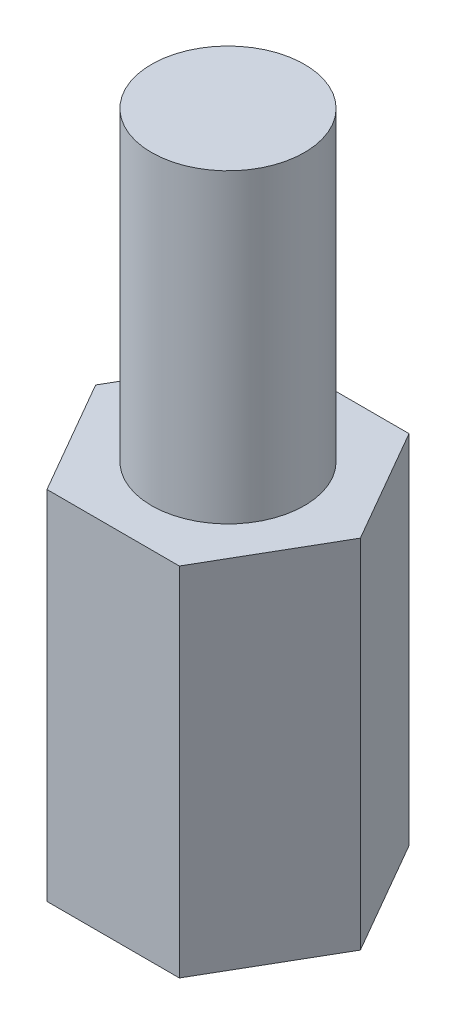
from build123d import *

# Parameters (mm, degrees)
EXTRUDE_1_DEPTH     = 7
SKETCH_2_R          = 1.25
CUT_EXTRUDE_1_DEPTH = 6.5
SKETCH_3_R          = 1.5
EXTRUDE_2_DEPTH     = 6


with BuildPart() as part:
    # Эскиз1 → Бобышка-Вытянуть1 (new body)
    with BuildSketch(Plane(origin=(0, 0, 0), x_dir=(1, 0, 0), z_dir=(0, 1, 0))):
        Polygon((-1.301734413, -2.25), (1.297689952, -2.252335071), (2.599424365, -0.002335071), (1.301734413, 2.25), (-1.297689952, 2.252335071), (-2.599424365, 0.002335071), align=None)
    extrude(amount=EXTRUDE_1_DEPTH)

    # Эскиз2 → Вырез-Вытянуть1 (cut)
    with BuildSketch(Plane.XZ):
        with Locations(Location((0, 0, 0), (0, 0, 270))):
            Circle(SKETCH_2_R)
    extrude(amount=-CUT_EXTRUDE_1_DEPTH, mode=Mode.SUBTRACT)


with BuildPart() as body_2:
    # Эскиз3 → Бобышка-Вытянуть2 (new body)
    with BuildSketch(Plane(origin=(0, 7, 0), x_dir=(1, 0, 0), z_dir=(0, 1, 0))):
        with Locations(Location((0, 0, 0), (0, 0, 270))):
            Circle(SKETCH_3_R)
    extrude(amount=EXTRUDE_2_DEPTH)


solid = Compound([part.part, body_2.part])
